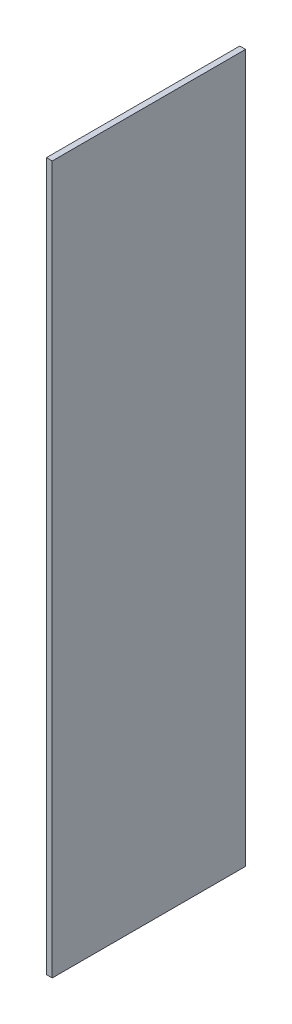
from build123d import *

# Parameters (mm, degrees)
SKETCH1_W           = 500
SKETCH1_H           = 1830
BOSS_EXTRUDE1_DEPTH = 15


with BuildPart() as part:
    # Sketch1 → Boss-Extrude1 (new body)
    with BuildSketch(Plane(origin=(0, 0, 0), x_dir=(0, 0, -1), z_dir=(1, 0, 0))):
        with Locations((250, 915)):
            Rectangle(SKETCH1_W, SKETCH1_H)
    extrude(amount=BOSS_EXTRUDE1_DEPTH)


solid = part.part
